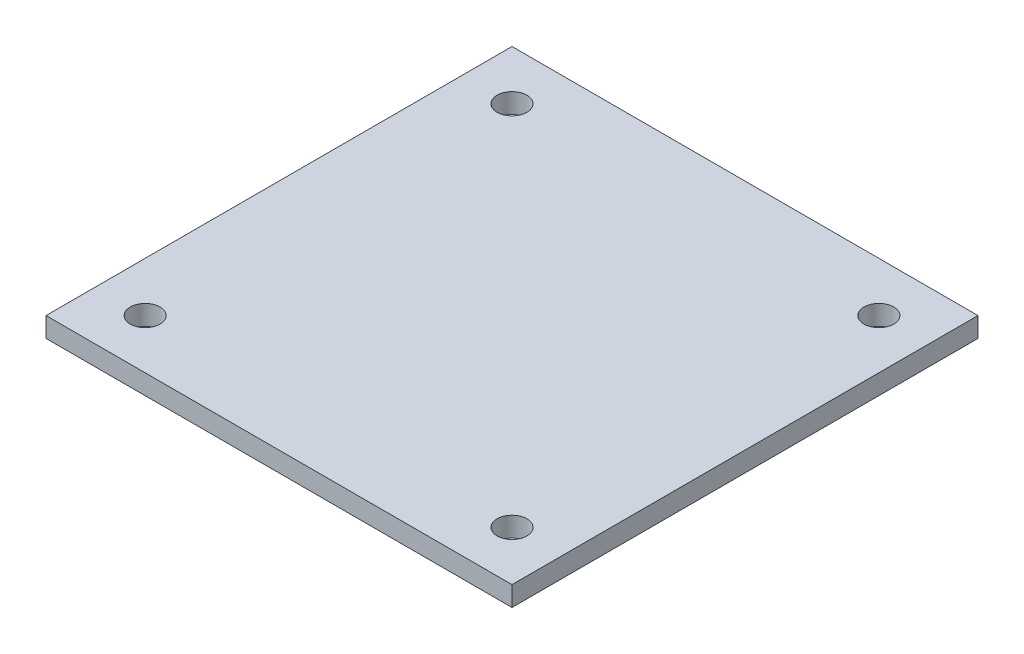
from build123d import *

# Parameters (mm, degrees)
IZIM1_W                     = 235
IZIM1_H                     = 235
Y_KSEKLIK_EKSTR_ZYON1_DEPTH = 10
IZIM2_R                     = 7.5
KES_EKSTR_ZYON1_DEPTH       = 167.470718146


with BuildPart() as part:
    # Çizim1 → Yükseklik-Ekstrüzyon1 (new body)
    with BuildSketch(Plane(origin=(0, 0, 0), x_dir=(1, 0, 0), z_dir=(0, 1, 0))):
        Rectangle(IZIM1_W, IZIM1_H)
    extrude(amount=Y_KSEKLIK_EKSTR_ZYON1_DEPTH)

    # Çizim2 → Kes-Ekstrüzyon1 (cut, through all)
    with BuildSketch(Plane(origin=(0, 10, 0), x_dir=(1, 0, 0), z_dir=(0, 1, 0))):
        with Locations(Location((-92.5, 92.5, 0), (0, 0, 270))):
            Circle(IZIM2_R)
        with Locations(Location((-92.5, -92.5, 0), (0, 0, 270))):
            Circle(IZIM2_R)
        with Locations(Location((92.5, -92.5, 0), (0, 0, 270))):
            Circle(IZIM2_R)
        with Locations(Location((92.5, 92.5, 0), (0, 0, 270))):
            Circle(IZIM2_R)
    extrude(amount=-KES_EKSTR_ZYON1_DEPTH, mode=Mode.SUBTRACT)


solid = part.part
